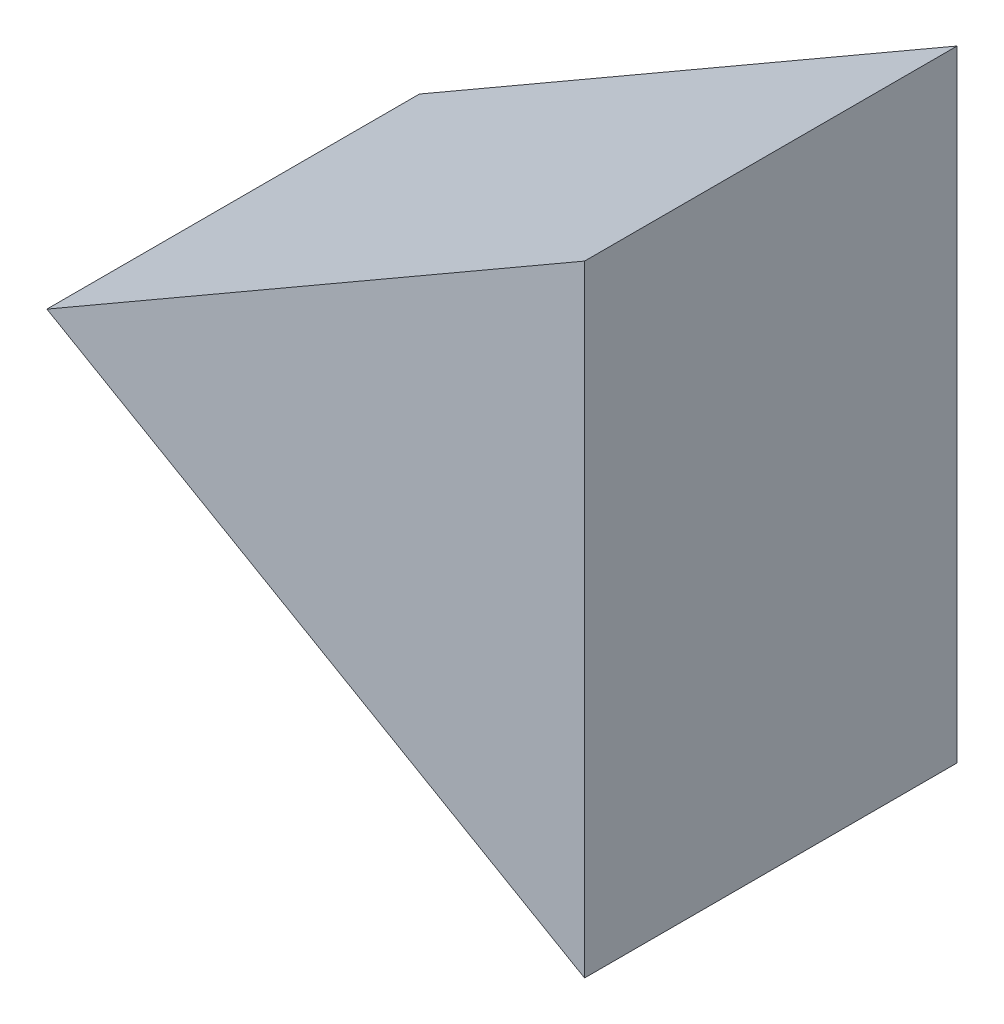
from build123d import *

# Parameters (mm, degrees)
EXTRUDE_1_DEPTH      = 300
EXTRUDE_1_DEPTH_BACK = 300


with BuildPart() as part:
    # ｽｹｯﾁ1 → ﾎﾞｽ - 押し出し1 (new, two sides: drawn at the far end of the back side and taken through both)
    with BuildSketch(Plane.XY.offset(-EXTRUDE_1_DEPTH_BACK)):
        Polygon((0, 0), (866.025403784, 500), (866.025403784, -500), align=None)
    extrude(amount=EXTRUDE_1_DEPTH + EXTRUDE_1_DEPTH_BACK)


solid = part.part
